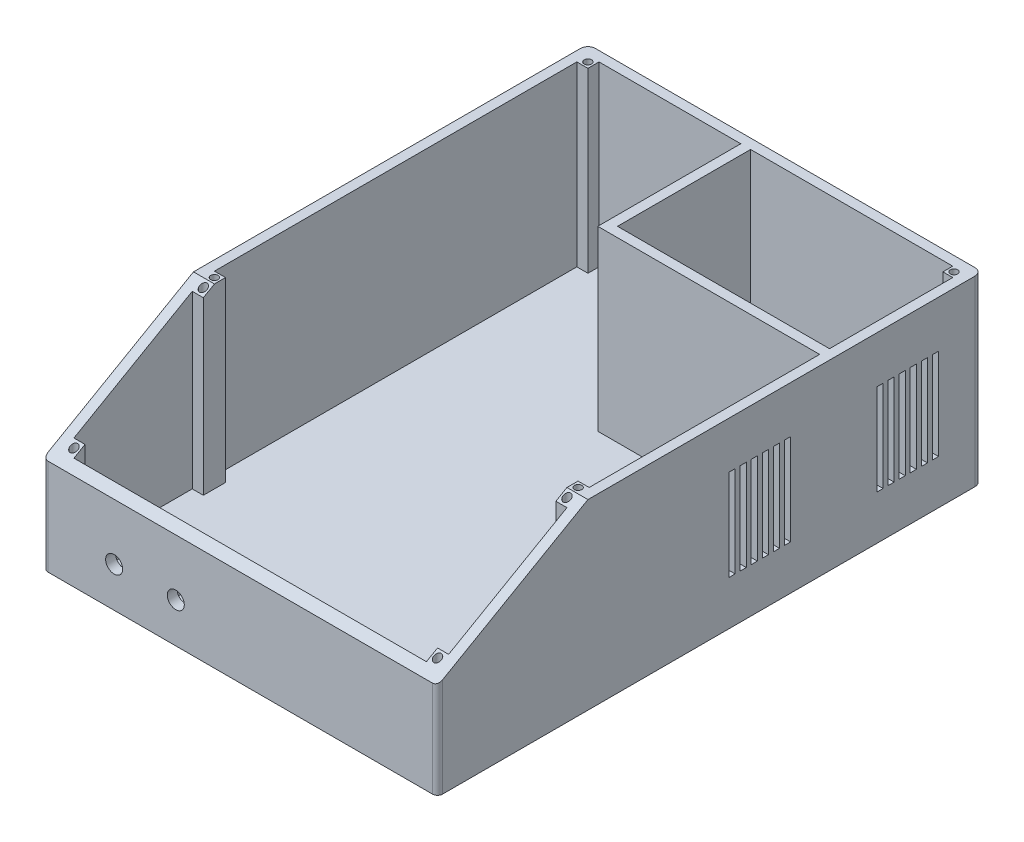
from build123d import *

# Parameters (mm, degrees)
SKETCH1_W            = 160
SKETCH1_H            = 221
BOSS_EXTRUDE2_DEPTH  = 74
CUT_EXTRUDE2_DEPTH   = 164
SKETCH8_W            = 152
SKETCH8_H            = 156
CUT_EXTRUDE3_DEPTH   = 72
SKETCH10_W           = 152
SKETCH10_H           = 72
CUT_EXTRUDE4_DEPTH   = 57
SKETCH12_W           = 4.5
SKETCH12_H           = 4.5
BOSS_EXTRUDE3_DEPTH  = 72
SKETCH13_W           = 4.5
SKETCH13_H           = 4.5
BOSS_EXTRUDE4_DEPTH  = 80
CUT_EXTRUDE5_DEPTH   = 80
CUT_EXTRUDE6_DEPTH   = 80
SKETCH18_W           = 90
SKETCH18_H           = 58
BOSS_EXTRUDE6_DEPTH  = 72
SKETCH21_W           = 86
SKETCH21_H           = 54
CUT_EXTRUDE7_DEPTH   = 72
SKETCH22_W           = 4
SKETCH22_H           = 4
BOSS_EXTRUDE7_DEPTH  = 72
SKETCH24_R           = 2.25
CUT_EXTRUDE8_DEPTH   = 5.9
SKETCH25_W           = 62.3
SKETCH25_H           = 20.1
BOSS_EXTRUDE8_DEPTH  = 16.5
FILLET1_R            = 3
FILLET2_R            = 3
FILLET3_R            = 2
FILLET4_R            = 2
SKETCH28_W           = 19.81
SKETCH28_H           = 10.54
BOSS_EXTRUDE10_DEPTH = 6.35
SKETCH29_W           = 2.5
SKETCH29_H           = 10.54
SKETCH29_W_2         = 2.4979753
BOSS_EXTRUDE11_DEPTH = 22.35
SKETCH33_R           = 3.45
CUT_EXTRUDE11_DEPTH  = 22.35
SKETCH34_R           = 1.55
SKETCH34_W           = 27.4
SKETCH34_H           = 19.4
CUT_EXTRUDE12_DEPTH  = 10
SKETCH44_R           = 1.5
CUT_EXTRUDE13_DEPTH  = 52
SKETCH47_R           = 1.5
CUT_EXTRUDE15_DEPTH  = 52
SKETCH48_R           = 1.5
CUT_EXTRUDE16_DEPTH  = 52
CUT_EXTRUDE19_START  = 15
SKETCH52_R           = 1.5
CUT_EXTRUDE19_DEPTH  = 69
SKETCH54_R           = 1.5
CUT_EXTRUDE20_DEPTH  = 52
SKETCH65_R           = 3.15
BOSS_EXTRUDE16_DEPTH = 10
SKETCH66_R           = 1.5
CUT_EXTRUDE24_DEPTH  = 15
SKETCH67_R           = 1.5
CUT_EXTRUDE25_DEPTH  = 15
SKETCH68_W           = 25
SKETCH68_H           = 37
CUT_EXTRUDE26_DEPTH  = 15
SKETCH69_W           = 2
SKETCH69_H           = 37
BOSS_EXTRUDE18_DEPTH = 4


with BuildPart() as part:
    # Sketch1 → Boss-Extrude2 (new body)
    with BuildSketch(Plane(origin=(0, 0, 0), x_dir=(1, 0, 0), z_dir=(0, 1, 0))):
        with Locations((0, -30.5)):
            Rectangle(SKETCH1_W, SKETCH1_H)
    extrude(amount=BOSS_EXTRUDE2_DEPTH)

    # Sketch7 → Cut-Extrude2 (cut)
    with BuildSketch(Plane(origin=(80, 0, 0), x_dir=(0, 0, -1), z_dir=(1, 0, 0))):
        Polygon((-141, 74), (-80, 74), (-141, 39), align=None)
    extrude(amount=-CUT_EXTRUDE2_DEPTH, mode=Mode.SUBTRACT)

    # Sketch8 → Cut-Extrude3 (cut)
    with BuildSketch(Plane(origin=(0, 74, 0), x_dir=(1, 0, 0), z_dir=(0, 1, 0))):
        with Locations((0, -2)):
            Rectangle(SKETCH8_W, SKETCH8_H)
    extrude(amount=-CUT_EXTRUDE3_DEPTH, mode=Mode.SUBTRACT)

    # Sketch10 → Cut-Extrude4 (cut)
    with BuildSketch(Plane(origin=(0, 0, 80), x_dir=(-1, 0, 0), z_dir=(0, 0, -1))):
        with Locations((0, 38)):
            Rectangle(SKETCH10_W, SKETCH10_H)
    extrude(amount=-CUT_EXTRUDE4_DEPTH, mode=Mode.SUBTRACT)

    # Sketch12 → Boss-Extrude3 (add)
    with BuildSketch(Plane(origin=(0, 2, 0), x_dir=(1, 0, 0), z_dir=(0, 1, 0))):
        with Locations((-73.75, 73.75)):
            Rectangle(SKETCH12_W, SKETCH12_H)
        with Locations((73.75, 73.75)):
            Rectangle(SKETCH12_W, SKETCH12_H)
        with Locations((-73.75, -77.75)):
            Rectangle(SKETCH12_W, SKETCH12_H)
        with Locations((73.75, -77.75)):
            Rectangle(SKETCH12_W, SKETCH12_H)
    extrude(amount=BOSS_EXTRUDE3_DEPTH)

    # Sketch13 → Boss-Extrude4 (add)
    with BuildSketch(Plane(origin=(0, 2, 0), x_dir=(1, 0, 0), z_dir=(0, 1, 0))):
        with Locations((-73.75, -82.25)):
            Rectangle(SKETCH13_W, SKETCH13_H)
        with Locations((-73.75, -134.75)):
            Rectangle(SKETCH13_W, SKETCH13_H)
        with Locations((73.75, -82.25)):
            Rectangle(SKETCH13_W, SKETCH13_H)
        with Locations((73.75, -134.75)):
            Rectangle(SKETCH13_W, SKETCH13_H)
    extrude(amount=BOSS_EXTRUDE4_DEPTH)

    # Sketch14 → Cut-Extrude5 (cut)
    with BuildSketch(Plane.ZY.offset(76)):
        Polygon((80, 82), (84.5, 82), (84.5, 71.418032787), (80, 74), align=None)
        Polygon((137, 41.295081967), (132.5, 43.87704918), (132.5, 82), (137, 82), align=None)
    extrude(amount=-CUT_EXTRUDE5_DEPTH, mode=Mode.SUBTRACT)

    # Sketch15 → Cut-Extrude6 (cut)
    with BuildSketch(Plane(origin=(76, 0, 0), x_dir=(0, 0, -1), z_dir=(1, 0, 0))):
        Polygon((-137, 41.295081967), (-132.5, 43.87704918), (-132.5, 82), (-137, 82), align=None)
        Polygon((-84.5, 71.418032787), (-80, 74), (-80, 82), (-84.5, 82), align=None)
    extrude(amount=-CUT_EXTRUDE6_DEPTH, mode=Mode.SUBTRACT)

    # Sketch18 → Boss-Extrude6 (add)
    with BuildSketch(Plane(origin=(0, 2, 0), x_dir=(1, 0, 0), z_dir=(0, 1, 0))):
        with Locations((31, 47)):
            Rectangle(SKETCH18_W, SKETCH18_H)
    extrude(amount=BOSS_EXTRUDE6_DEPTH)

    # Sketch21 → Cut-Extrude7 (cut)
    with BuildSketch(Plane(origin=(0, 74, 0), x_dir=(1, 0, 0), z_dir=(0, 1, 0))):
        with Locations((33, 49)):
            Rectangle(SKETCH21_W, SKETCH21_H)
    extrude(amount=-CUT_EXTRUDE7_DEPTH, mode=Mode.SUBTRACT)

    # Sketch22 → Boss-Extrude7 (add)
    with BuildSketch(Plane(origin=(0, 2, 0), x_dir=(1, 0, 0), z_dir=(0, 1, 0))):
        with Locations((74, 74)):
            Rectangle(SKETCH22_W, SKETCH22_H)
    extrude(amount=BOSS_EXTRUDE7_DEPTH)

    # Sketch24 → Cut-Extrude8 (cut)
    with BuildSketch(Plane.ZY.offset(14)):
        with Locations((-68.205440171, 13.198688186)):
            Circle(SKETCH24_R)
        with Locations((-68.205440171, 20.198688186)):
            Circle(SKETCH24_R)
    extrude(amount=-CUT_EXTRUDE8_DEPTH, mode=Mode.SUBTRACT)

    # Sketch25 → Boss-Extrude8 (add)
    with BuildSketch(Plane(origin=(0, 2, 0), x_dir=(1, 0, 0), z_dir=(0, 1, 0))):
        with Locations((34.15, 40.95)):
            Rectangle(SKETCH25_W, SKETCH25_H)
    extrude(amount=BOSS_EXTRUDE8_DEPTH)

    # Fillet1
    fillet1_edges = [part.edges().sort_by_distance(p)[0] for p in [
        (80, 37, -80),
    ]]
    fillet(fillet1_edges, radius=FILLET1_R)

    # Fillet2
    fillet2_edges = [part.edges().sort_by_distance(p)[0] for p in [
        (-80, 37, -80),
    ]]
    fillet(fillet2_edges, radius=FILLET2_R)

    # Fillet3
    fillet3_edges = [part.edges().sort_by_distance(p)[0] for p in [
        (80, 19.5, 141),
    ]]
    fillet(fillet3_edges, radius=FILLET3_R)

    # Fillet4
    fillet4_edges = [part.edges().sort_by_distance(p)[0] for p in [
        (-80, 19.5, 141),
    ]]
    fillet(fillet4_edges, radius=FILLET4_R)

    # Sketch28 → Boss-Extrude10 (add)
    with BuildSketch(Plane(origin=(0, 2, 0), x_dir=(1, 0, 0), z_dir=(0, 1, 0))):
        with Locations((-51.085, -131.73)):
            Rectangle(SKETCH28_W, SKETCH28_H)
        with Locations((-26.085, -131.73)):
            Rectangle(SKETCH28_W, SKETCH28_H)
    extrude(amount=BOSS_EXTRUDE10_DEPTH)

    # Sketch29 → Boss-Extrude11 (add)
    with BuildSketch(Plane(origin=(0, 2, 0), x_dir=(1, 0, 0), z_dir=(0, 1, 0))):
        with Locations((-61.14, -131.73)):
            Rectangle(SKETCH29_W, SKETCH29_H)
        with Locations((-41.03, -131.73)):
            Rectangle(SKETCH29_W, SKETCH29_H)
        with Locations((-36.14, -131.73)):
            Rectangle(SKETCH29_W, SKETCH29_H)
        with Locations((-16.03101235, -131.73)):
            Rectangle(SKETCH29_W_2, SKETCH29_H)
    extrude(amount=BOSS_EXTRUDE11_DEPTH)

    # Sketch33 → Cut-Extrude11 (cut)
    with BuildSketch(Plane(origin=(0, 0, 137), x_dir=(-1, 0, 0), z_dir=(0, 0, -1))):
        with Locations((51.187629476, 16.178708102)):
            Circle(SKETCH33_R)
        with Locations((26.187629476, 16.178708102)):
            Circle(SKETCH33_R)
    extrude(amount=-CUT_EXTRUDE11_DEPTH, mode=Mode.SUBTRACT)

    # Sketch34 → Cut-Extrude12 (cut)
    with BuildSketch(Plane.XY.offset(-76)):
        with Locations((64.8, 15.464095432)):
            Circle(SKETCH34_R)
        with Locations((26.8, 15.4)):
            Circle(SKETCH34_R)
        with Locations((45.8, 15.2)):
            Rectangle(SKETCH34_W, SKETCH34_H)
    extrude(amount=-CUT_EXTRUDE12_DEPTH, mode=Mode.SUBTRACT)

    # Sketch44 → Cut-Extrude13 (cut)
    with BuildSketch(Plane(origin=(0, 74, 0), x_dir=(1, 0, 0), z_dir=(0, 1, 0))):
        with Locations(Location((-73.75, 73.75, 0), (0, 0, 270))):
            Circle(SKETCH44_R)
    extrude(amount=-CUT_EXTRUDE13_DEPTH, mode=Mode.SUBTRACT)

    # Sketch47 → Cut-Extrude15 (cut)
    with BuildSketch(Plane(origin=(0, 74, 0), x_dir=(1, 0, 0), z_dir=(0, 1, 0))):
        with Locations(Location((74.25, 74.25, 0), (0, 0, 270))):
            Circle(SKETCH47_R)
    extrude(amount=-CUT_EXTRUDE15_DEPTH, mode=Mode.SUBTRACT)

    # Sketch48 → Cut-Extrude16 (cut)
    with BuildSketch(Plane(origin=(0, 74, 0), x_dir=(1, 0, 0), z_dir=(0, 1, 0))):
        with Locations(Location((73.75, -77.75, 0), (0, 0, 270))):
            Circle(SKETCH48_R)
    extrude(amount=-CUT_EXTRUDE16_DEPTH, mode=Mode.SUBTRACT)

    # Sketch52 → Cut-Extrude19 (cut)
    with BuildSketch(Plane(origin=(0, 2, 0), x_dir=(1, 0, 0), z_dir=(0, 1, 0)).offset(CUT_EXTRUDE19_START)):
        with Locations(Location((73.75, -82.25, 0), (0, 0, 270))):
            Circle(SKETCH52_R)
        with Locations(Location((-73.75, -82.25, 0), (0, 0, 270))):
            Circle(SKETCH52_R)
        with Locations(Location((-73.75, -134.75, 0), (0, 0, 270))):
            Circle(SKETCH52_R)
        with Locations(Location((73.75, -134.75, 0), (0, 0, 270))):
            Circle(SKETCH52_R)
    extrude(amount=CUT_EXTRUDE19_DEPTH, mode=Mode.SUBTRACT)

    # Sketch54 → Cut-Extrude20 (cut)
    with BuildSketch(Plane(origin=(0, 74, 0), x_dir=(1, 0, 0), z_dir=(0, 1, 0))):
        with Locations(Location((-73.75, -77.75, 0), (0, 0, 270))):
            Circle(SKETCH54_R)
    extrude(amount=-CUT_EXTRUDE20_DEPTH, mode=Mode.SUBTRACT)

    # Sketch65 → Boss-Extrude16 (add)
    with BuildSketch(Plane.XY.offset(-76)):
        with Locations(Location((26.859149397, 15.23123202, 0), (0, 0, 180))):
            Circle(SKETCH65_R)
        with Locations(Location((64.799149397, 15.23123202, 0), (0, 0, 180))):
            Circle(SKETCH65_R)
    extrude(amount=BOSS_EXTRUDE16_DEPTH)

    # Sketch66 → Cut-Extrude24 (cut)
    with BuildSketch(Plane.XY.offset(-76)):
        with Locations(Location((26.840517017, 15.277397511, 0), (0, 0, 218.813706581))):
            Circle(SKETCH66_R)
    extrude(amount=CUT_EXTRUDE24_DEPTH, mode=Mode.SUBTRACT)

    # Sketch67 → Cut-Extrude25 (cut)
    with BuildSketch(Plane.XY.offset(-76)):
        with Locations(Location((64.952271836, 15.4, 0), (0, 0, 261.804750978))):
            Circle(SKETCH67_R)
    extrude(amount=CUT_EXTRUDE25_DEPTH, mode=Mode.SUBTRACT)

    # Sketch68 → Cut-Extrude26 (cut)
    with BuildSketch(Plane(origin=(80, 0, 0), x_dir=(0, 0, -1), z_dir=(1, 0, 0))):
        with Locations((-10.266957333, 36.517419115)):
            Rectangle(SKETCH68_W, SKETCH68_H)
        with Locations((49.733042667, 36.517419115)):
            Rectangle(SKETCH68_W, SKETCH68_H)
    extrude(amount=-CUT_EXTRUDE26_DEPTH, mode=Mode.SUBTRACT)

    # Sketch69 → Boss-Extrude18 (add)
    with BuildSketch(Plane(origin=(80, 0, 0), x_dir=(0, 0, -1), z_dir=(1, 0, 0))):
        with Locations((40.733042667, 36.517419115)):
            Rectangle(SKETCH69_W, SKETCH69_H)
        with Locations((45.233042667, 36.517419115)):
            Rectangle(SKETCH69_W, SKETCH69_H)
        with Locations((49.733042667, 36.517419115)):
            Rectangle(SKETCH69_W, SKETCH69_H)
        with Locations((54.233042667, 36.517419115)):
            Rectangle(SKETCH69_W, SKETCH69_H)
        with Locations((58.733042667, 36.517419115)):
            Rectangle(SKETCH69_W, SKETCH69_H)
        with Locations((-19.266957333, 36.517419115)):
            Rectangle(SKETCH69_W, SKETCH69_H)
        with Locations((-14.766957333, 36.517419115)):
            Rectangle(SKETCH69_W, SKETCH69_H)
        with Locations((-10.266957333, 36.517419115)):
            Rectangle(SKETCH69_W, SKETCH69_H)
        with Locations((-5.766957333, 36.517419115)):
            Rectangle(SKETCH69_W, SKETCH69_H)
        with Locations((-1.266957333, 36.517419115)):
            Rectangle(SKETCH69_W, SKETCH69_H)
    extrude(amount=-BOSS_EXTRUDE18_DEPTH)


solid = part.part
